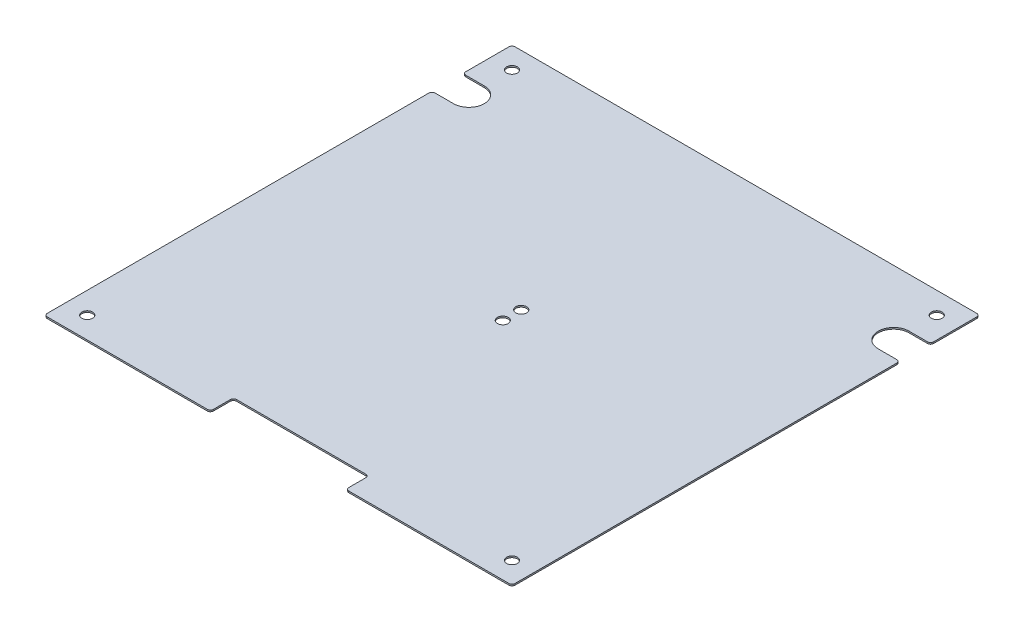
from build123d import *

# Parameters (mm, degrees)
SKETCH1_W                = 304
SKETCH1_H                = 304
BOSS_EXTRUDE1_DEPTH      = 1
SKETCH2_W                = 88
SKETCH2_H                = 15
CUT_EXTRUDE1_DEPTH       = 215.962787477
FILLET1_R                = 2
F_7_0_7_DIAMETER_HOLE1_D = 7
SKETCH6_W                = 40
SKETCH6_H                = 25
BOSS_EXTRUDE2_DEPTH      = 1


with BuildPart() as part:
    # Sketch1 → Boss-Extrude1 (new body)
    with BuildSketch(Plane(origin=(0, 0, 0), x_dir=(1, 0, 0), z_dir=(0, 1, 0))):
        Rectangle(SKETCH1_W, SKETCH1_H)
    extrude(amount=BOSS_EXTRUDE1_DEPTH)

    # Sketch2 → Cut-Extrude1 (cut, through all)
    with BuildSketch(Plane(origin=(0, 1, 0), x_dir=(1, 0, 0), z_dir=(0, 1, 0))):
        with Locations((0, -144.5)):
            Rectangle(SKETCH2_W, SKETCH2_H)
        with BuildLine():
            Line((-152, 100), (-138, 100))
            ThreePointArc((-138, 100), (-128, 110), (-138, 120))
            Line((-138, 120), (-152, 120))
            Line((-152, 120), (-152, 100))
        make_face()
        with BuildLine():
            Line((152, 100), (138, 100))
            ThreePointArc((138, 100), (128, 110), (138, 120))
            Line((138, 120), (152, 120))
            Line((152, 120), (152, 100))
        make_face()
    extrude(amount=-CUT_EXTRUDE1_DEPTH, mode=Mode.SUBTRACT)

    # Fillet1
    fillet1_edges = [part.edges().sort_by_distance(p)[0] for p in [
        (44, 0.5, 152),
        (-44, 0.5, 152),
        (-44, 0.5, 137),
        (44, 0.5, 137),
        (-152, 0.5, -100),
        (-152, 0.5, -120),
        (152, 0.5, -120),
        (152, 0.5, -100),
        (-152, 0.5, -152),
        (152, 0.5, -152),
        (152, 0.5, 152),
        (-152, 0.5, 152),
    ]]
    fillet(fillet1_edges, radius=FILLET1_R)

    # Ø7.0 (7) Diameter Hole1 (through all)
    with Locations(Plane(origin=(0, 1, 0), x_dir=(1, 0, 0), z_dir=(0, 1, 0))):
        with Locations((-138, -138), (138, 138), (-138, 138), (138, -138), (0, -6), (0, 6)):
            Hole(F_7_0_7_DIAMETER_HOLE1_D / 2)

    # Sketch6 → Boss-Extrude2 (add)
    with BuildSketch(Plane.XZ):
        with Locations((0, 109.5)):
            Rectangle(SKETCH6_W, SKETCH6_H)
    extrude(amount=BOSS_EXTRUDE2_DEPTH)


solid = part.part
